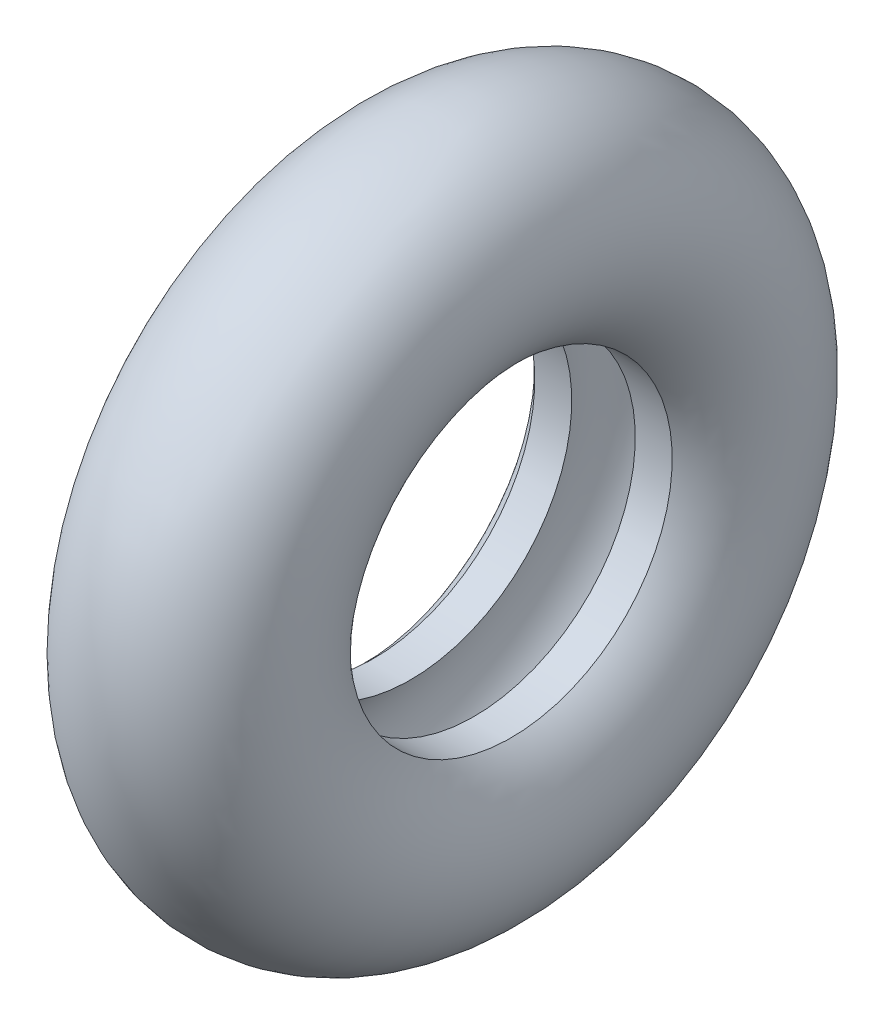
from build123d import *


with BuildPart() as part:
    # Esquisse1 → Révolution1 (revolve)
    with BuildSketch(Plane.XY, mode=Mode.PRIVATE) as r_volution1_sk:
        with BuildLine():
            Line((-36.213732547, 85), (-16.743190407, 85))
            ThreePointArc((-16.743190407, 85), (0, 174.995), (16.743190407, 85))
            Line((16.743190407, 85), (36.213732547, 85))
            ThreePointArc((36.213732547, 85), (0, 184.995), (-36.213732547, 85))
        make_face()
    revolve(r_volution1_sk.sketch.rotate(Axis((-106.608138565, 0, 0), (1, 0, 0)), 90), axis=Axis((-106.608138565, 0, 0), (1, 0, 0)))


solid = part.part
